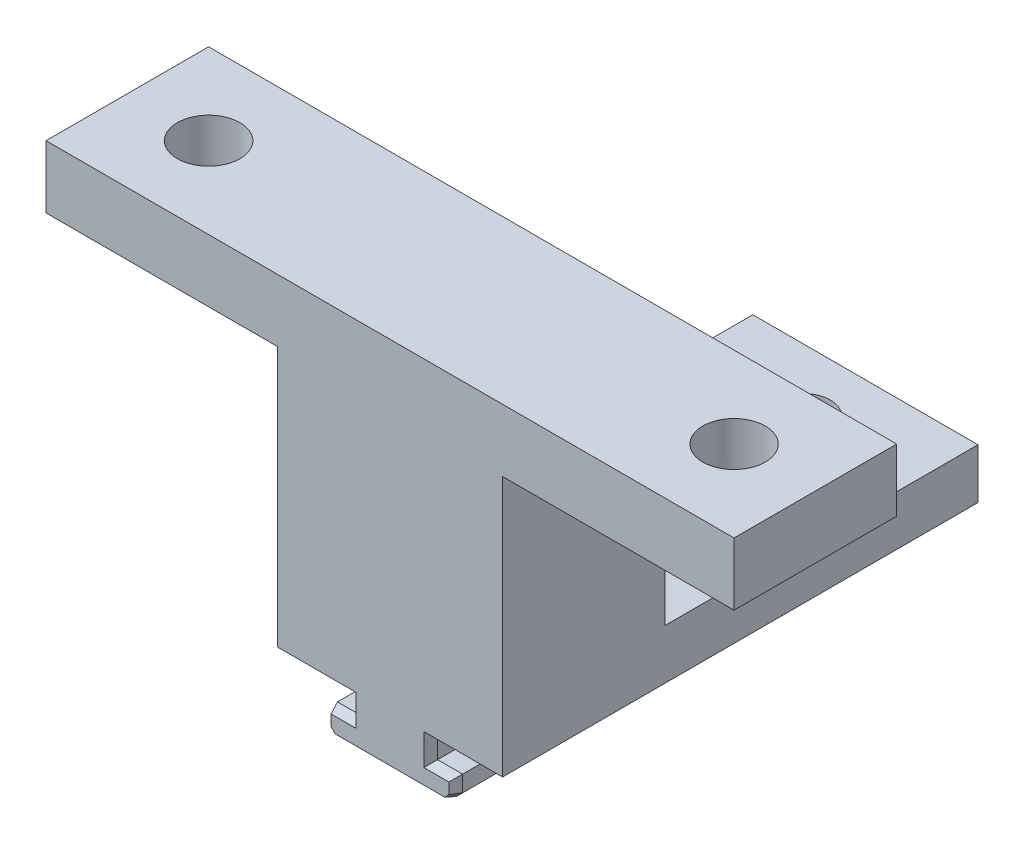
from build123d import *
from OCP.BRepFilletAPI import BRepFilletAPI_MakeChamfer

# Parameters (mm, degrees)
EXTRUDE_1_DEPTH     = 13
SKETCH_2_R          = 2.5
CUT_EXTRUDE_1_DEPTH = 43.582742984
EXTRUDE_2_DEPTH     = 25
EXTRUDE_3_DEPTH     = 13
SKETCH_4_R          = 2.2
CUT_EXTRUDE_3_DEPTH = 44.087005002
CHAMFER_3_SIZE      = 0.8
CHAMFER_3_SIZE2     = 0.291176187


with BuildPart() as part:
    # 草图1 → 凸台-拉伸1 (new body)
    with BuildSketch(Plane.XY):
        Polygon((3, 10), (9, 10), (9, 30.8), (27.5, 30.8), (27.5, 35.8), (-27.5, 35.8), (-27.5, 30.8), (-9, 30.8), (-9, 10), (-3, 10), (-3, 7.8), (-5, 7.8), (-5, 6.5), (-4.5, 6), (4.5, 6), (5, 6.5), (5, 7.8), (3, 7.8), align=None)
    extrude(amount=EXTRUDE_1_DEPTH)

    # 草图2 → 切除-拉伸1 (cut, through all)
    with BuildSketch(Plane(origin=(0, 35.8, 0), x_dir=(1, 0, 0), z_dir=(0, 1, 0))):
        with Locations(Location((21, -6.5, 0), (0, 0, 270))):
            Circle(SKETCH_2_R)
        with Locations((-21, -6.5)):
            Circle(SKETCH_2_R)
    extrude(amount=-CUT_EXTRUDE_1_DEPTH, mode=Mode.SUBTRACT)

    # 草图1<10> → 凸台-拉伸2 (add)
    with BuildSketch(Plane.XY):
        Polygon((3, 10), (9, 10), (9, 14), (-9, 14), (-9, 10), (-3, 10), align=None)
    extrude(amount=-EXTRUDE_2_DEPTH)

    # 草图1<11> → 凸台-拉伸3 (add)
    with BuildSketch(Plane.XY):
        Polygon((3, 7.8), (5, 7.8), (5, 6.5), (4.5, 6), (-4.5, 6), (-5, 6.5), (-5, 7.8), (-3, 7.8), (-3, 10), (3, 10), align=None)
    extrude(amount=-EXTRUDE_3_DEPTH)

    # 草图4 → 切除-拉伸3 (cut, through all)
    with BuildSketch(Plane(origin=(0, 14, 0), x_dir=(1, 0, 0), z_dir=(0, 1, 0))):
        with Locations(Location((0, 20, 0), (0, 0, 270))):
            Circle(SKETCH_4_R)
    extrude(amount=-CUT_EXTRUDE_3_DEPTH, mode=Mode.SUBTRACT)

    # 倒角3: one chamfer whose edges measure the first distance from different faces: ONE call of the kernel's chamfer builder (chamfer() names one face for all edges)
    chamfer_3_edges_1 = [part.edges().sort_by_distance(p)[0] for p in [
        (-3, 8.9, 13),
    ]]
    chamfer_3_side_1 = [part.faces().sort_by_distance(p)[0] for p in [
        (-3, 8.9, 0),
    ]]
    chamfer_3_edges_2 = [part.edges().sort_by_distance(p)[0] for p in [
        (3, 8.9, 13),
    ]]
    chamfer_3_side_2 = [part.faces().sort_by_distance(p)[0] for p in [
        (3, 8.9, 0),
    ]]
    chamfer_3_edges_3 = [part.edges().sort_by_distance(p)[0] for p in [
        (4, 7.8, 13),
    ]]
    chamfer_3_side_3 = [part.faces().sort_by_distance(p)[0] for p in [
        (4, 7.8, 0),
    ]]
    chamfer_3_edges_4 = [part.edges().sort_by_distance(p)[0] for p in [
        (5, 7.15, 13),
    ]]
    chamfer_3_side_4 = [part.faces().sort_by_distance(p)[0] for p in [
        (5, 7.15, 0),
    ]]
    chamfer_3_edges_5 = [part.edges().sort_by_distance(p)[0] for p in [
        (4.75, 6.25, 13),
    ]]
    chamfer_3_side_5 = [part.faces().sort_by_distance(p)[0] for p in [
        (4.75, 6.25, 0),
    ]]
    chamfer_3_edges_6 = [part.edges().sort_by_distance(p)[0] for p in [
        (0, 6, 13),
    ]]
    chamfer_3_side_6 = [part.faces().sort_by_distance(p)[0] for p in [
        (0, 6, 0),
    ]]
    chamfer_3_edges_7 = [part.edges().sort_by_distance(p)[0] for p in [
        (-4, 7.8, 13),
    ]]
    chamfer_3_side_7 = [part.faces().sort_by_distance(p)[0] for p in [
        (-4, 7.8, 0),
    ]]
    chamfer_3_edges_8 = [part.edges().sort_by_distance(p)[0] for p in [
        (-5, 7.15, 13),
    ]]
    chamfer_3_side_8 = [part.faces().sort_by_distance(p)[0] for p in [
        (-5, 7.15, 0),
    ]]
    chamfer_3_edges_9 = [part.edges().sort_by_distance(p)[0] for p in [
        (-4.75, 6.25, 13),
    ]]
    chamfer_3_side_9 = [part.faces().sort_by_distance(p)[0] for p in [
        (-4.75, 6.25, 0),
    ]]
    chamfer_3 = BRepFilletAPI_MakeChamfer(part.part.solid().wrapped)
    for e in chamfer_3_edges_1:
        chamfer_3.Add(CHAMFER_3_SIZE, CHAMFER_3_SIZE2, e.wrapped, chamfer_3_side_1[0].wrapped)  # the first distance lies on this face
    for e in chamfer_3_edges_2:
        chamfer_3.Add(CHAMFER_3_SIZE, CHAMFER_3_SIZE2, e.wrapped, chamfer_3_side_2[0].wrapped)  # the first distance lies on this face
    for e in chamfer_3_edges_3:
        chamfer_3.Add(CHAMFER_3_SIZE, CHAMFER_3_SIZE2, e.wrapped, chamfer_3_side_3[0].wrapped)  # the first distance lies on this face
    for e in chamfer_3_edges_4:
        chamfer_3.Add(CHAMFER_3_SIZE, CHAMFER_3_SIZE2, e.wrapped, chamfer_3_side_4[0].wrapped)  # the first distance lies on this face
    for e in chamfer_3_edges_5:
        chamfer_3.Add(CHAMFER_3_SIZE, CHAMFER_3_SIZE2, e.wrapped, chamfer_3_side_5[0].wrapped)  # the first distance lies on this face
    for e in chamfer_3_edges_6:
        chamfer_3.Add(CHAMFER_3_SIZE, CHAMFER_3_SIZE2, e.wrapped, chamfer_3_side_6[0].wrapped)  # the first distance lies on this face
    for e in chamfer_3_edges_7:
        chamfer_3.Add(CHAMFER_3_SIZE, CHAMFER_3_SIZE2, e.wrapped, chamfer_3_side_7[0].wrapped)  # the first distance lies on this face
    for e in chamfer_3_edges_8:
        chamfer_3.Add(CHAMFER_3_SIZE, CHAMFER_3_SIZE2, e.wrapped, chamfer_3_side_8[0].wrapped)  # the first distance lies on this face
    for e in chamfer_3_edges_9:
        chamfer_3.Add(CHAMFER_3_SIZE, CHAMFER_3_SIZE2, e.wrapped, chamfer_3_side_9[0].wrapped)  # the first distance lies on this face
    add(Compound.cast(chamfer_3.Shape()), mode=Mode.REPLACE)


solid = part.part
